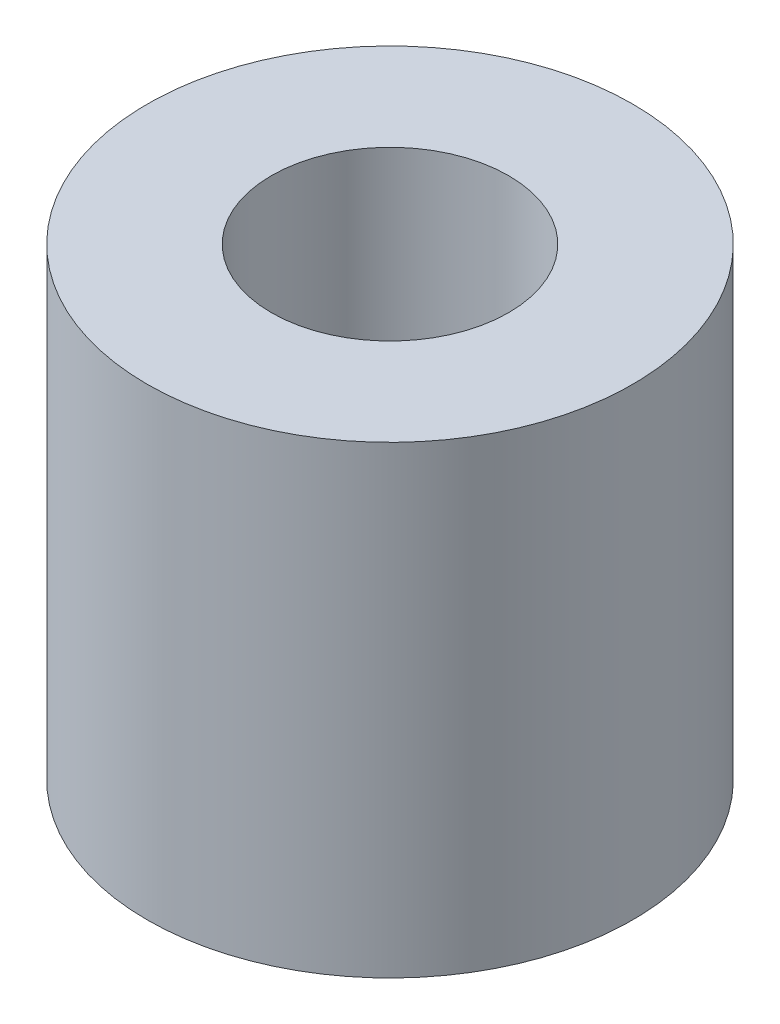
from build123d import *

# Parameters (mm, degrees)
SKETCH1_R           = 2.25
SKETCH1_R_2         = 1.1
BOSS_EXTRUDE1_DEPTH = 4.3


with BuildPart() as part:
    # Sketch1 → Boss-Extrude1 (new body)
    with BuildSketch(Plane(origin=(0, 0, 0), x_dir=(1, 0, 0), z_dir=(0, 1, 0))):
        with Locations(Location((0, 0, 0), (0, 0, 90))):
            Circle(SKETCH1_R)
        with Locations(Location((0, 0, 0), (0, 0, 90))):
            Circle(SKETCH1_R_2, mode=Mode.SUBTRACT)
    extrude(amount=BOSS_EXTRUDE1_DEPTH)


solid = part.part
